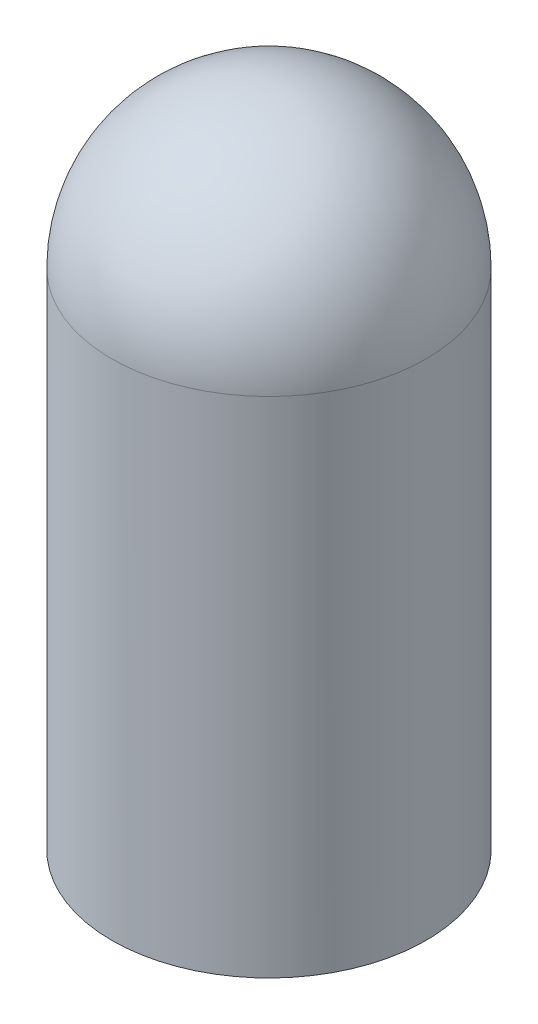
from build123d import *

# Parameters (mm, degrees)
SHELL1_T = -0.5


with BuildPart() as part:
    # Sketch1 → Revolve1 (revolve)
    with BuildSketch(Plane.XY, mode=Mode.PRIVATE) as revolve1_sk:
        with BuildLine():
            Line((9.75, 0), (9.75, 31.25))
            ThreePointArc((9.75, 31.25), (6.894291117, 38.144291117), (0, 41))
            Line((0, 41), (0, 31.25))
            Line((0, 31.25), (0, 0))
            Line((0, 0), (9.75, 0))
        make_face()
    revolve(revolve1_sk.sketch.rotate(Axis((0, 0, 0), (0, 1, 0)), 90), axis=Axis((0, 0, 0), (0, 1, 0)))

    # Shell1
    shell1_openings = [part.faces().sort_by_distance(p)[0] for p in [
        (0, 0, 0),
    ]]
    offset(amount=SHELL1_T, openings=shell1_openings, kind=Kind.INTERSECTION)


solid = part.part
